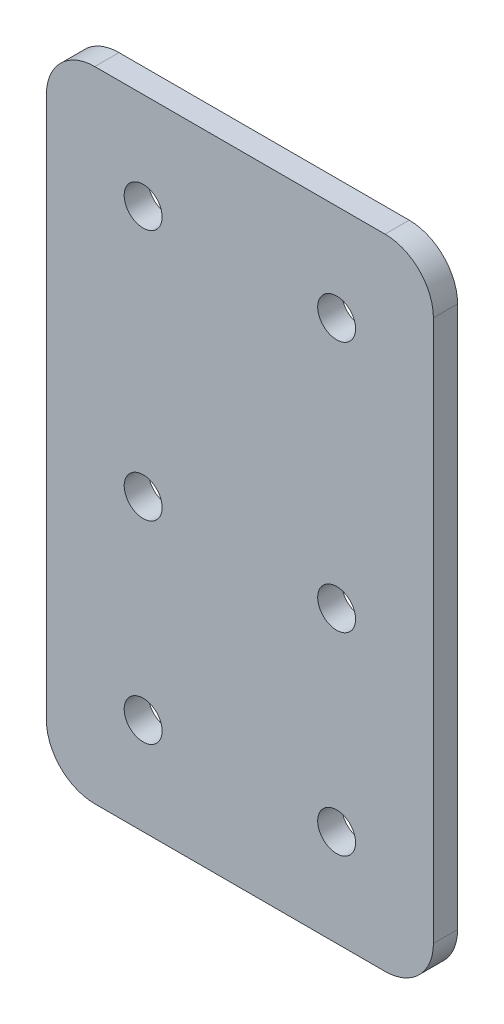
from build123d import *

# Parameters (mm, degrees)
SKETCH2_W           = 50.8
SKETCH2_H           = 83.82
BOSS_EXTRUDE1_DEPTH = 3.175
SKETCH3_R           = 2.4892
CUT_EXTRUDE1_DEPTH  = 99.063821183
FILLET1_R           = 6.35


with BuildPart() as part:
    # Sketch2 → Boss-Extrude1 (new body)
    with BuildSketch(Plane.XY):
        with Locations((25.4, 41.91)):
            Rectangle(SKETCH2_W, SKETCH2_H)
    extrude(amount=-BOSS_EXTRUDE1_DEPTH)

    # Sketch3 → Cut-Extrude1 (cut, through all)
    with BuildSketch(Plane.XY):
        with Locations((12.7, 71.12)):
            Circle(SKETCH3_R)
        with Locations((38.1, 71.12)):
            Circle(SKETCH3_R)
        with Locations((12.7, 38.1)):
            Circle(SKETCH3_R)
        with Locations((12.7, 12.7)):
            Circle(SKETCH3_R)
        with Locations((12.7, -12.7)):
            Circle(SKETCH3_R)
        with Locations((12.7, -38.1)):
            Circle(SKETCH3_R)
        with Locations((12.7, -63.5)):
            Circle(SKETCH3_R)
        with Locations((38.1, 12.7)):
            Circle(SKETCH3_R)
        with Locations((38.1, -12.7)):
            Circle(SKETCH3_R)
        with Locations((38.1, -38.1)):
            Circle(SKETCH3_R)
        with Locations((38.1, -63.5)):
            Circle(SKETCH3_R)
        with Locations((38.1, 38.1)):
            Circle(SKETCH3_R)
    extrude(amount=-CUT_EXTRUDE1_DEPTH, mode=Mode.SUBTRACT)

    # Fillet1
    fillet1_edges = [part.edges().sort_by_distance(p)[0] for p in [
        (0, 83.82, -1.5875),
        (50.8, 83.82, -1.5875),
        (50.8, 0, -1.5875),
        (0, 0, -1.5875),
    ]]
    fillet(fillet1_edges, radius=FILLET1_R)


solid = part.part
